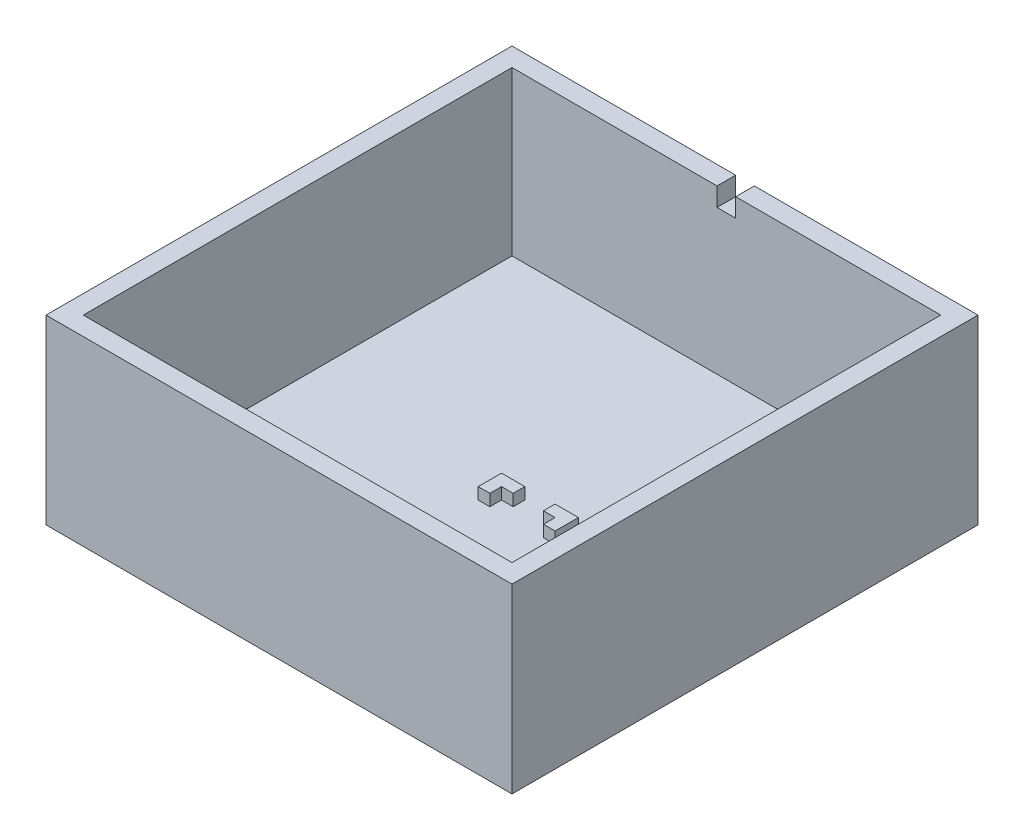
from build123d import *

# Parameters (mm, degrees)
SKETCH1_W           = 100
SKETCH1_H           = 100
BOSS_EXTRUDE1_DEPTH = 4
SKETCH2_W           = 100
SKETCH2_H           = 100
SKETCH2_W_2         = 92
SKETCH2_H_2         = 92
BOSS_EXTRUDE2_DEPTH = 35
SKETCH3_W           = 4
SKETCH3_H           = 4
CUT_EXTRUDE1_DEPTH  = 4
BOSS_EXTRUDE3_DEPTH = 2.5
SKETCH5_W           = 5.75
SKETCH5_H           = 4
CUT_EXTRUDE2_DEPTH  = 4


with BuildPart() as part:
    # Sketch1 → Boss-Extrude1 (new body)
    with BuildSketch(Plane(origin=(0, 0, 0), x_dir=(1, 0, 0), z_dir=(0, 1, 0))):
        Rectangle(SKETCH1_W, SKETCH1_H)
    extrude(amount=BOSS_EXTRUDE1_DEPTH)

    # Sketch2 → Boss-Extrude2 (add)
    with BuildSketch(Plane(origin=(0, 4, 0), x_dir=(1, 0, 0), z_dir=(0, 1, 0))):
        Rectangle(SKETCH2_W, SKETCH2_H)
        Rectangle(SKETCH2_W_2, SKETCH2_H_2, mode=Mode.SUBTRACT)
    extrude(amount=BOSS_EXTRUDE2_DEPTH)

    # Sketch3 → Cut-Extrude1 (cut)
    with BuildSketch(Plane(origin=(0, 0, -50), x_dir=(-1, 0, 0), z_dir=(0, 0, -1))):
        with Locations((0, 37)):
            Rectangle(SKETCH3_W, SKETCH3_H)
    extrude(amount=-CUT_EXTRUDE1_DEPTH, mode=Mode.SUBTRACT)

    # Sketch4 → Boss-Extrude3 (add)
    with BuildSketch(Plane(origin=(0, 4, 0), x_dir=(1, 0, 0), z_dir=(0, 1, 0))):
        Polygon((-1.75, -0.5), (0.75, -0.5), (0.75, 2), (-4.25, 2), (-4.25, -3), (-1.75, -3), align=None)
        Polygon((7.25, -0.5), (9.75, -0.5), (9.75, -3), (12.25, -3), (12.25, 2), (7.25, 2), align=None)
        Polygon((12.25, -14.5), (9.75, -14.5), (9.75, -17), (7.25, -17), (7.25, -19.5), (12.25, -19.5), align=None)
        Polygon((-1.75, -17), (-1.75, -14.5), (-4.25, -14.5), (-4.25, -19.5), (0.75, -19.5), (0.75, -17), align=None)
    extrude(amount=BOSS_EXTRUDE3_DEPTH)

    # Sketch5 → Cut-Extrude2 (cut)
    with BuildSketch(Plane(origin=(0, 4, 0), x_dir=(1, 0, 0), z_dir=(0, 1, 0))):
        with Locations((1.125, -15)):
            Rectangle(SKETCH5_W, SKETCH5_H)
    extrude(amount=-CUT_EXTRUDE2_DEPTH, mode=Mode.SUBTRACT)


solid = part.part
